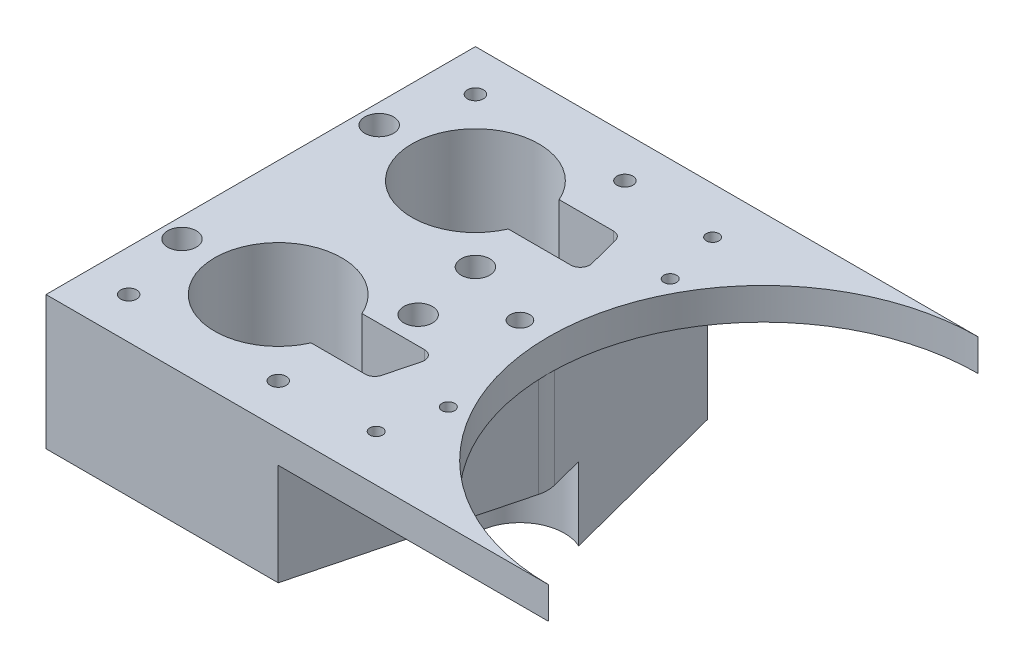
from build123d import *
from OCP.BRepFilletAPI import BRepFilletAPI_MakeChamfer

# Parameters (mm, degrees)
SALIENTE_EXTRUIR2_DEPTH     = 23
CROQUIS7_R                  = 20
CORTAR_EXTRUIR1_DEPTH       = 16
CROQUIS8_R                  = 10.25
CORTAR_EXTRUIR2_DEPTH       = 65.838641661
SALIENTE_EXTRUIR3_START     = 32
CROQUIS9_R                  = 20
CROQUIS9_R_2                = 3.075
CROQUIS9_R_3                = 10.25
SALIENTE_EXTRUIR3_DEPTH     = 32
CORTAR_EXTRUIR3_START       = -7
CROQUIS10_R                 = 20
CORTAR_EXTRUIR3_DEPTH       = 112.607172695
SALIENTE_EXTRUIR4_START     = 20
CROQUIS11_R                 = 3.075
CROQUIS11_R_2               = 20
SALIENTE_EXTRUIR4_DEPTH     = 20
CROQUIS12_R                 = 63
CORTAR_EXTRUIR4_DEPTH       = 3
CROQUIS13_R                 = 55
CORTAR_EXTRUIR5_DEPTH       = 10
SALIENTE_EXTRUIR5_START     = 10
SALIENTE_EXTRUIR5_DEPTH     = 10
CHAFL_N1_SIZE               = 8
CHAFL_N1_SIZE2              = 4.618802154
CROQUIS15_R                 = 6
CORTAR_EXTRUIR6_DEPTH       = 14.8
CORTAR_EXTRUIR7_REACH       = 233.334
CROQUIS17_R                 = 1.5
CORTAR_EXTRUIR9_REACH       = 225.907
CROQUIS19_R                 = 1.5
CORTAR_EXTRUIR10_DEPTH      = 232.333633525
CORTAR_EXTRUIR11_DEPTH      = 50
CROQUIS22_R                 = 3
CORTAR_EXTRUIR12_DEPTH      = 3
CROQUIS23_R                 = 3
CORTAR_EXTRUIR13_DEPTH      = 3
CROQUIS25_R                 = 2.5
CORTAR_EXTRUIR15_DEPTH      = 224.906788642
CROQUIS24_R                 = 2.5
CORTAR_EXTRUIR14_DEPTH      = 232.333633525
CROQUIS26_R                 = 2
CORTAR_EXTRUIR16_DEPTH      = 223.070371729
CROQUIS27_R                 = 3.5
CORTAR_EXTRUIR17_DEPTH      = 5
CORTAR_EXTRUIR18_DEPTH      = 3.25
CROQUIS29_R                 = 1.5
CORTAR_EXTRUIR19_DEPTH      = 10
CORTAR_EXTRUIR20_DEPTH      = 223.070371729
CORTAR_EXTRUIR20_DEPTH_BACK = 223.070371729
CROQUIS30_R                 = 67.5
CROQUIS31_R                 = 2.5
CORTAR_EXTRUIR21_DEPTH      = 180.872176837
CROQUIS32_R                 = 4.5
CORTAR_EXTRUIR22_DEPTH      = 5
CROQUIS33_W                 = 158
CROQUIS33_H                 = 20
CORTAR_EXTRUIR23_DEPTH      = 202.442299431
CROQUIS34_R                 = 4.5
CORTAR_EXTRUIR24_DEPTH      = 12
CROQUIS35_R                 = 4.5
CORTAR_EXTRUIR25_DEPTH      = 45
CROQUIS36_R                 = 4.5
CORTAR_EXTRUIR26_DEPTH      = 23
CROQUIS37_R                 = 4.5
CORTAR_EXTRUIR27_DEPTH      = 23.6
CORTAR_EXTRUIR28_DEPTH      = 35
CORTAR_EXTRUIR29_DEPTH      = 23


with BuildPart() as part:
    # Croquis2 → Saliente-Extruir2 (new body)
    with BuildSketch(Plane(origin=(0, 0, 0), x_dir=(1, 0, 0), z_dir=(0, 1, 0))):
        with BuildLine():
            Line((32.725022686, -35), (-35, -35))
            Line((-35, -35), (-35, 35))
            Line((-35, 35), (38, 35))
            Line((38, 35), (52.182846342, -19.705264464))
            ThreePointArc((52.182846342, -19.705264464), (38.869791903, -20.762030653), (32.5, -32.5))
            ThreePointArc((32.5, -32.5), (32.556369153, -33.755053307), (32.725022686, -35))
        make_face()
    extrude(amount=SALIENTE_EXTRUIR2_DEPTH)

    # Croquis7 → Cortar-Extruir1 (cut)
    with BuildSketch(Plane(origin=(0, 23, 0), x_dir=(1, 0, 0), z_dir=(0, 1, 0))):
        with Locations(Location((1.5, -1.5, 0), (0, 0, 270))):
            Circle(CROQUIS7_R)
    extrude(amount=-CORTAR_EXTRUIR1_DEPTH, mode=Mode.SUBTRACT)

    # Croquis8 → Cortar-Extruir2 (cut, through all)
    with BuildSketch(Plane(origin=(0, 7, 0), x_dir=(1, 0, 0), z_dir=(0, 1, 0))):
        with Locations(Location((1.5, -1.5, 0), (0, 0, 270))):
            Circle(CROQUIS8_R)
    extrude(amount=-CORTAR_EXTRUIR2_DEPTH, mode=Mode.SUBTRACT)

    # Croquis9 → Saliente-Extruir3 (add)
    with BuildSketch(Plane(origin=(0, 23, 0), x_dir=(1, 0, 0), z_dir=(0, 1, 0)).offset(SALIENTE_EXTRUIR3_START)):
        with BuildLine():
            Line((-35, 35), (-35, -100))
            Line((-35, -100), (38, -100))
            Line((38, -100), (54.849357366, -35.009621588))
            ThreePointArc((54.849357366, -35.009621588), (55.169388384, -32.5), (54.849357366, -29.990378412))
            Line((54.849357366, -29.990378412), (38, 35))
            Line((38, 35), (-35, 35))
        make_face()
        with Locations(Location((1.5, -1.5, 0), (0, 0, 270))):
            Circle(CROQUIS9_R, mode=Mode.SUBTRACT)
        with Locations(Location((46.5, -32.5, 0), (0, 0, 270))):
            Circle(CROQUIS9_R_2, mode=Mode.SUBTRACT)
        with Locations(Location((1.5, -63.5, 0), (0, 0, 90))):
            Circle(CROQUIS9_R_3, mode=Mode.SUBTRACT)
    extrude(amount=-SALIENTE_EXTRUIR3_DEPTH)

    # Croquis10 → Cortar-Extruir3 (cut, through all)
    with BuildSketch(Plane.XZ.offset(-23).offset(CORTAR_EXTRUIR3_START)):
        with Locations(Location((1.5, 63.5, 0), (0, 0, 90))):
            Circle(CROQUIS10_R)
    extrude(amount=-CORTAR_EXTRUIR3_DEPTH, mode=Mode.SUBTRACT)

    # Croquis11 → Saliente-Extruir4 (add)
    with BuildSketch(Plane(origin=(0, 55, 0), x_dir=(1, 0, 0), z_dir=(0, 1, 0)).offset(SALIENTE_EXTRUIR4_START)):
        with BuildLine():
            Line((123, 35), (-35, 35))
            Line((-35, 35), (-35, -100))
            Line((-35, -100), (123, -100))
            ThreePointArc((123, -100), (190.5, -32.5), (123, 35))
        make_face()
        with Locations(Location((46.5, -32.5, 0), (0, 0, 270))):
            Circle(CROQUIS11_R, mode=Mode.SUBTRACT)
        with Locations(Location((1.5, -63.5, 0), (0, 0, 270))):
            Circle(CROQUIS11_R_2, mode=Mode.SUBTRACT)
        with Locations(Location((1.5, -1.5, 0), (0, 0, 270))):
            Circle(CROQUIS11_R_2, mode=Mode.SUBTRACT)
    extrude(amount=-SALIENTE_EXTRUIR4_DEPTH)

    # Croquis12 → Cortar-Extruir4 (cut)
    with BuildSketch(Plane.XZ.offset(-55)):
        with Locations(Location((123, 32.5, 0), (0, 0, 270))):
            Circle(CROQUIS12_R)
    extrude(amount=-CORTAR_EXTRUIR4_DEPTH, mode=Mode.SUBTRACT)

    # Croquis13 → Cortar-Extruir5 (cut)
    with BuildSketch(Plane.XZ.offset(-58)):
        with Locations(Location((123, 32.5, 0), (0, 0, 270))):
            Circle(CROQUIS13_R)
    extrude(amount=-CORTAR_EXTRUIR5_DEPTH, mode=Mode.SUBTRACT)

    # Croquis14 → Saliente-Extruir5 (add)
    with BuildSketch(Plane(origin=(0, 75, 0), x_dir=(1, 0, 0), z_dir=(0, 1, 0)).offset(SALIENTE_EXTRUIR5_START)):
        with BuildLine():
            Line((-35, -100), (123, -100))
            ThreePointArc((123, -100), (190.5, -32.5), (123, 35))
            Line((123, 35), (-35, 35))
            Line((-35, 35), (-35, -100))
        make_face()
    extrude(amount=-SALIENTE_EXTRUIR5_DEPTH)

    # Chaflán1: one chamfer whose edges measure the first distance from different faces: ONE call of the kernel's chamfer builder (chamfer() names one face for all edges)
    chafl_n1_edges_1 = [part.edges().sort_by_distance(p)[0] for p in [
        (190.5, 85, 32.5),
    ]]
    chafl_n1_side_1 = [part.faces().sort_by_distance(p)[0] for p in [
        (190.5, 70, 32.5),
    ]]
    chafl_n1_edges_2 = [part.edges().sort_by_distance(p)[0] for p in [
        (44, 85, -35),
    ]]
    chafl_n1_side_2 = [part.faces().sort_by_distance(p)[0] for p in [
        (24.509708738, 50.509708738, -35),
    ]]
    chafl_n1_edges_3 = [part.edges().sort_by_distance(p)[0] for p in [
        (44, 85, 100),
    ]]
    chafl_n1_side_3 = [part.faces().sort_by_distance(p)[0] for p in [
        (29.969474279, 59.765969474, 100),
    ]]
    chafl_n1 = BRepFilletAPI_MakeChamfer(part.part.solid().wrapped)
    for e in chafl_n1_edges_1:
        chafl_n1.Add(CHAFL_N1_SIZE, CHAFL_N1_SIZE2, e.wrapped, chafl_n1_side_1[0].wrapped)  # the first distance lies on this face
    for e in chafl_n1_edges_2:
        chafl_n1.Add(CHAFL_N1_SIZE, CHAFL_N1_SIZE2, e.wrapped, chafl_n1_side_2[0].wrapped)  # the first distance lies on this face
    for e in chafl_n1_edges_3:
        chafl_n1.Add(CHAFL_N1_SIZE, CHAFL_N1_SIZE2, e.wrapped, chafl_n1_side_3[0].wrapped)  # the first distance lies on this face
    add(Compound.cast(chafl_n1.Shape()), mode=Mode.REPLACE)

    # Croquis15 → Cortar-Extruir6 (cut)
    with BuildSketch(Plane.XZ.offset(-68)):
        with Locations(Location((123, 32.5, 0), (0, 0, 270))):
            Circle(CROQUIS15_R)
    extrude(amount=-CORTAR_EXTRUIR6_DEPTH, mode=Mode.SUBTRACT)

    # Croquis17 → Cortar-Extruir7 (cut, up to next)
    with BuildSketch(Plane.XZ, mode=Mode.PRIVATE) as cortar_extruir7_sk1:
        with Locations(Location((16.5, 1.5, 0), (0, 0, 270))):
            Circle(CROQUIS17_R)
    cortar_extruir7_tool1 = extrude(cortar_extruir7_sk1.sketch, amount=-CORTAR_EXTRUIR7_REACH, mode=Mode.PRIVATE) & part.part
    # Croquis17 → Cortar-Extruir7 (cut, up to next)
    with BuildSketch(Plane.XZ, mode=Mode.PRIVATE) as cortar_extruir7_sk2:
        with Locations(Location((-6, -11.490381057, 0), (0, 0, 270))):
            Circle(CROQUIS17_R)
    cortar_extruir7_tool2 = extrude(cortar_extruir7_sk2.sketch, amount=-CORTAR_EXTRUIR7_REACH, mode=Mode.PRIVATE) & part.part
    # Croquis17 → Cortar-Extruir7 (cut, up to next)
    with BuildSketch(Plane.XZ, mode=Mode.PRIVATE) as cortar_extruir7_sk3:
        with Locations(Location((-6, 14.490381057, 0), (0, 0, 270))):
            Circle(CROQUIS17_R)
    cortar_extruir7_tool3 = extrude(cortar_extruir7_sk3.sketch, amount=-CORTAR_EXTRUIR7_REACH, mode=Mode.PRIVATE) & part.part
    # Croquis17 → Cortar-Extruir7 (cut, up to next)
    with BuildSketch(Plane.XZ, mode=Mode.PRIVATE) as cortar_extruir7_sk4:
        with Locations(Location((13.624355653, 8.5, 0), (0, 0, 270))):
            Circle(CROQUIS17_R)
    cortar_extruir7_tool4 = extrude(cortar_extruir7_sk4.sketch, amount=-CORTAR_EXTRUIR7_REACH, mode=Mode.PRIVATE) & part.part
    # Croquis17 → Cortar-Extruir7 (cut, up to next)
    with BuildSketch(Plane.XZ, mode=Mode.PRIVATE) as cortar_extruir7_sk5:
        with Locations(Location((1.5, -12.5, 0), (0, 0, 270))):
            Circle(CROQUIS17_R)
    cortar_extruir7_tool5 = extrude(cortar_extruir7_sk5.sketch, amount=-CORTAR_EXTRUIR7_REACH, mode=Mode.PRIVATE) & part.part
    # Croquis17 → Cortar-Extruir7 (cut, up to next)
    with BuildSketch(Plane.XZ, mode=Mode.PRIVATE) as cortar_extruir7_sk6:
        with Locations(Location((-10.624355653, 8.5, 0), (0, 0, 270))):
            Circle(CROQUIS17_R)
    cortar_extruir7_tool6 = extrude(cortar_extruir7_sk6.sketch, amount=-CORTAR_EXTRUIR7_REACH, mode=Mode.PRIVATE) & part.part
    add(cortar_extruir7_tool1.solids().sort_by_distance((16.5, 0, 1.5))[0], mode=Mode.SUBTRACT)
    add(cortar_extruir7_tool2.solids().sort_by_distance((-6, 0, -11.490381))[0], mode=Mode.SUBTRACT)
    add(cortar_extruir7_tool3.solids().sort_by_distance((-6, 0, 14.490381))[0], mode=Mode.SUBTRACT)
    add(cortar_extruir7_tool4.solids().sort_by_distance((13.624356, 0, 8.5))[0], mode=Mode.SUBTRACT)
    add(cortar_extruir7_tool5.solids().sort_by_distance((1.5, 0, -12.5))[0], mode=Mode.SUBTRACT)
    add(cortar_extruir7_tool6.solids().sort_by_distance((-10.624356, 0, 8.5))[0], mode=Mode.SUBTRACT)

    # Croquis19 → Cortar-Extruir9 (cut, up to next)
    with BuildSketch(Plane.XZ.offset(-23), mode=Mode.PRIVATE) as cortar_extruir9_sk1:
        with Locations(Location((16.5, 63.5, 0), (0, 0, 270))):
            Circle(CROQUIS19_R)
    cortar_extruir9_tool1 = extrude(cortar_extruir9_sk1.sketch, amount=-CORTAR_EXTRUIR9_REACH, mode=Mode.PRIVATE) & part.part
    # Croquis19 → Cortar-Extruir9 (cut, up to next)
    with BuildSketch(Plane.XZ.offset(-23), mode=Mode.PRIVATE) as cortar_extruir9_sk2:
        with Locations(Location((-6, 50.509618943, 0), (0, 0, 270))):
            Circle(CROQUIS19_R)
    cortar_extruir9_tool2 = extrude(cortar_extruir9_sk2.sketch, amount=-CORTAR_EXTRUIR9_REACH, mode=Mode.PRIVATE) & part.part
    # Croquis19 → Cortar-Extruir9 (cut, up to next)
    with BuildSketch(Plane.XZ.offset(-23), mode=Mode.PRIVATE) as cortar_extruir9_sk3:
        with Locations(Location((-6, 76.490381057, 0), (0, 0, 270))):
            Circle(CROQUIS19_R)
    cortar_extruir9_tool3 = extrude(cortar_extruir9_sk3.sketch, amount=-CORTAR_EXTRUIR9_REACH, mode=Mode.PRIVATE) & part.part
    # Croquis19 → Cortar-Extruir9 (cut, up to next)
    with BuildSketch(Plane.XZ.offset(-23), mode=Mode.PRIVATE) as cortar_extruir9_sk4:
        with Locations(Location((13.624355653, 70.5, 0), (0, 0, 270))):
            Circle(CROQUIS19_R)
    cortar_extruir9_tool4 = extrude(cortar_extruir9_sk4.sketch, amount=-CORTAR_EXTRUIR9_REACH, mode=Mode.PRIVATE) & part.part
    # Croquis19 → Cortar-Extruir9 (cut, up to next)
    with BuildSketch(Plane.XZ.offset(-23), mode=Mode.PRIVATE) as cortar_extruir9_sk5:
        with Locations(Location((1.5, 49.5, 0), (0, 0, 270))):
            Circle(CROQUIS19_R)
    cortar_extruir9_tool5 = extrude(cortar_extruir9_sk5.sketch, amount=-CORTAR_EXTRUIR9_REACH, mode=Mode.PRIVATE) & part.part
    # Croquis19 → Cortar-Extruir9 (cut, up to next)
    with BuildSketch(Plane.XZ.offset(-23), mode=Mode.PRIVATE) as cortar_extruir9_sk6:
        with Locations(Location((-10.624355653, 70.5, 0), (0, 0, 270))):
            Circle(CROQUIS19_R)
    cortar_extruir9_tool6 = extrude(cortar_extruir9_sk6.sketch, amount=-CORTAR_EXTRUIR9_REACH, mode=Mode.PRIVATE) & part.part
    add(cortar_extruir9_tool1.solids().sort_by_distance((16.5, 23, 63.5))[0], mode=Mode.SUBTRACT)
    add(cortar_extruir9_tool2.solids().sort_by_distance((-6, 23, 50.509619))[0], mode=Mode.SUBTRACT)
    add(cortar_extruir9_tool3.solids().sort_by_distance((-6, 23, 76.490381))[0], mode=Mode.SUBTRACT)
    add(cortar_extruir9_tool4.solids().sort_by_distance((13.624356, 23, 70.5))[0], mode=Mode.SUBTRACT)
    add(cortar_extruir9_tool5.solids().sort_by_distance((1.5, 23, 49.5))[0], mode=Mode.SUBTRACT)
    add(cortar_extruir9_tool6.solids().sort_by_distance((-10.624356, 23, 70.5))[0], mode=Mode.SUBTRACT)

    # Croquis20 → Cortar-Extruir10 (cut, through all)
    with BuildSketch(Plane.XZ):
        with BuildLine():
            Line((42.3656995, 5.747113524), (39.773106907, -4.252886476))
            ThreePointArc((39.773106907, -4.252886476), (38.705054743, -5.872620854), (36.869116213, -6.5))
            Line((36.869116213, -6.5), (19.83030278, -6.5))
            ThreePointArc((19.83030278, -6.5), (21.5, 1.5), (19.83030278, 9.5))
            Line((19.83030278, 9.5), (39.461708805, 9.5))
            ThreePointArc((39.461708805, 9.5), (41.834329659, 8.33593853), (42.3656995, 5.747113524))
        make_face()
    extrude(amount=-CORTAR_EXTRUIR10_DEPTH, mode=Mode.SUBTRACT)

    # Croquis21 → Cortar-Extruir11 (cut)
    with BuildSketch(Plane.XZ.offset(-23)):
        with BuildLine():
            Line((39.461708805, 55.5), (19.83030278, 55.5))
            ThreePointArc((19.83030278, 55.5), (21.5, 63.5), (19.83030278, 71.5))
            Line((19.83030278, 71.5), (36.869116213, 71.5))
            ThreePointArc((36.869116213, 71.5), (38.705054743, 70.872620854), (39.773106907, 69.252886476))
            Line((39.773106907, 69.252886476), (42.3656995, 59.252886476))
            ThreePointArc((42.3656995, 59.252886476), (41.834329659, 56.66406147), (39.461708805, 55.5))
        make_face()
    extrude(amount=-CORTAR_EXTRUIR11_DEPTH, mode=Mode.SUBTRACT)

    # Croquis22 → Cortar-Extruir12 (cut)
    with BuildSketch(Plane.XZ):
        with Locations(Location((-6, 14.490381057, 0), (0, 0, 270))):
            Circle(CROQUIS22_R)
        with Locations(Location((-10.624355653, 8.5, 0), (0, 0, 270))):
            Circle(CROQUIS22_R)
        with Locations(Location((-6, -11.490381057, 0), (0, 0, 270))):
            Circle(CROQUIS22_R)
        with Locations(Location((1.5, -12.5, 0), (0, 0, 270))):
            Circle(CROQUIS22_R)
        with Locations(Location((16.5, 1.5, 0), (0, 0, 270))):
            Circle(CROQUIS22_R)
        with Locations(Location((13.624355653, 8.5, 0), (0, 0, 270))):
            Circle(CROQUIS22_R)
    extrude(amount=-CORTAR_EXTRUIR12_DEPTH, mode=Mode.SUBTRACT)

    # Croquis23 → Cortar-Extruir13 (cut)
    with BuildSketch(Plane.XZ.offset(-23)):
        with Locations(Location((-6, 76.490381057, 0), (0, 0, 270))):
            Circle(CROQUIS23_R)
        with Locations(Location((-10.624355653, 70.5, 0), (0, 0, 270))):
            Circle(CROQUIS23_R)
        with Locations(Location((-6, 50.509618943, 0), (0, 0, 270))):
            Circle(CROQUIS23_R)
        with Locations(Location((1.5, 49.5, 0), (0, 0, 270))):
            Circle(CROQUIS23_R)
        with Locations(Location((16.5, 63.5, 0), (0, 0, 270))):
            Circle(CROQUIS23_R)
        with Locations(Location((13.624355653, 70.5, 0), (0, 0, 270))):
            Circle(CROQUIS23_R)
    extrude(amount=-CORTAR_EXTRUIR13_DEPTH, mode=Mode.SUBTRACT)

    # Croquis25 → Cortar-Extruir15 (cut, through all)
    with BuildSketch(Plane.XZ.offset(-23)):
        with Locations(Location((-28.75, 63.5, 0), (0, 0, 270))):
            Circle(CROQUIS25_R)
        with Locations(Location((29, 47, 0), (0, 0, 270))):
            Circle(CROQUIS25_R)
    extrude(amount=-CORTAR_EXTRUIR15_DEPTH, mode=Mode.SUBTRACT)

    # Croquis24 → Cortar-Extruir14 (cut, through all)
    with BuildSketch(Plane.XZ):
        with Locations(Location((-28.75, 1.5, 0), (0, 0, 270))):
            Circle(CROQUIS24_R)
        with Locations(Location((25, 25, 0), (0, 0, 270))):
            Circle(CROQUIS24_R)
    extrude(amount=-CORTAR_EXTRUIR14_DEPTH, mode=Mode.SUBTRACT)

    # Croquis26 → Cortar-Extruir16 (cut, through all)
    with BuildSketch(Plane.XZ.offset(-55)):
        with Locations(Location((54.186793756, 85.381197846, 0), (0, 0, 270))):
            Circle(CROQUIS26_R)
        with Locations(Location((58.853460423, 67.381197846, 0), (0, 0, 270))):
            Circle(CROQUIS26_R)
        with Locations(Location((58.853460423, -2.381197846, 0), (0, 0, 90))):
            Circle(CROQUIS26_R)
        with Locations(Location((54.186793756, -20.381197846, 0), (0, 0, 90))):
            Circle(CROQUIS26_R)
    extrude(amount=-CORTAR_EXTRUIR16_DEPTH, mode=Mode.SUBTRACT)

    # Croquis27 → Cortar-Extruir17 (cut)
    with BuildSketch(Plane(origin=(0, 85, 0), x_dir=(1, 0, 0), z_dir=(0, 1, 0))):
        with Locations(Location((54.186793756, 20.381197846, 0), (0, 0, 270))):
            Circle(CROQUIS27_R)
        with Locations(Location((58.853460423, 2.381197846, 0), (0, 0, 270))):
            Circle(CROQUIS27_R)
        with Locations(Location((58.853460423, -67.381197846, 0), (0, 0, 270))):
            Circle(CROQUIS27_R)
        with Locations(Location((54.186793756, -85.381197846, 0), (0, 0, 270))):
            Circle(CROQUIS27_R)
    extrude(amount=-CORTAR_EXTRUIR17_DEPTH, mode=Mode.SUBTRACT)

    # Croquis28 → Cortar-Extruir18 (cut)
    with BuildSketch(Plane.XZ.offset(-55)):
        Polygon((55.222779206, 81.385253968), (58.165375392, 84.280415625), (57.129389942, 88.276359503), (53.150808306, 89.377141725), (50.20821212, 86.481980068), (51.24419757, 82.48603619), align=None)
        Polygon((59.889445873, 63.385253968), (62.832042059, 66.280415625), (61.796056609, 70.276359503), (57.817474973, 71.377141725), (54.874878787, 68.481980068), (55.910864237, 64.48603619), align=None)
        Polygon((59.889445873, 1.614746032), (55.910864237, 0.51396381), (54.874878787, -3.481980068), (57.817474973, -6.377141725), (61.796056609, -5.276359503), (62.832042059, -1.280415625), align=None)
        Polygon((55.222779206, -16.385253968), (51.24419757, -17.48603619), (50.20821212, -21.481980068), (53.150808306, -24.377141725), (57.129389942, -23.276359503), (58.165375392, -19.280415625), align=None)
    extrude(amount=-CORTAR_EXTRUIR18_DEPTH, mode=Mode.SUBTRACT)

    # Croquis29 → Cortar-Extruir19 (cut)
    with BuildSketch(Plane.XZ.offset(-68)):
        with Locations(Location((160.5, 32.5, 0), (0, 0, 270))):
            Circle(CROQUIS29_R)
        with Locations(Location((141.75, 0.024047358, 0), (0, 0, 270))):
            Circle(CROQUIS29_R)
        with Locations(Location((104.25, 0.024047358, 0), (0, 0, 270))):
            Circle(CROQUIS29_R)
        with Locations(Location((85.5, 32.5, 0), (0, 0, 270))):
            Circle(CROQUIS29_R)
        with Locations(Location((104.25, 64.975952642, 0), (0, 0, 270))):
            Circle(CROQUIS29_R)
        with Locations(Location((141.75, 64.975952642, 0), (0, 0, 270))):
            Circle(CROQUIS29_R)
    extrude(amount=-CORTAR_EXTRUIR19_DEPTH, mode=Mode.SUBTRACT)

    # Croquis30 → Cortar-Extruir20 (cut, two sides: drawn at the far end of the back side and taken through both)
    with BuildSketch(Plane.XZ.offset(-55).offset(-CORTAR_EXTRUIR20_DEPTH_BACK)):
        with Locations((123, 32.5)):
            Circle(CROQUIS30_R)
    extrude(amount=CORTAR_EXTRUIR20_DEPTH + CORTAR_EXTRUIR20_DEPTH_BACK, mode=Mode.SUBTRACT)

    # Croquis31 → Cortar-Extruir21 (cut, through all)
    with BuildSketch(Plane(origin=(0, 85, 0), x_dir=(1, 0, 0), z_dir=(0, 1, 0))):
        with Locations(Location((-22, 22, 0), (0, 0, 270))):
            Circle(CROQUIS31_R)
        with Locations(Location((25, 22, 0), (0, 0, 270))):
            Circle(CROQUIS31_R)
        with Locations(Location((25, -87, 0), (0, 0, 270))):
            Circle(CROQUIS31_R)
        with Locations(Location((-22, -87, 0), (0, 0, 270))):
            Circle(CROQUIS31_R)
    extrude(amount=-CORTAR_EXTRUIR21_DEPTH, mode=Mode.SUBTRACT)

    # Croquis32 → Cortar-Extruir22 (cut)
    with BuildSketch(Plane(origin=(0, 85, 0), x_dir=(1, 0, 0), z_dir=(0, 1, 0))):
        with Locations(Location((-22, 22, 0), (0, 0, 270))):
            Circle(CROQUIS32_R)
        with Locations(Location((25, 22, 0), (0, 0, 270))):
            Circle(CROQUIS32_R)
        with Locations(Location((-22, -87, 0), (0, 0, 270))):
            Circle(CROQUIS32_R)
        with Locations(Location((25, -87, 0), (0, 0, 270))):
            Circle(CROQUIS32_R)
    extrude(amount=-CORTAR_EXTRUIR22_DEPTH, mode=Mode.SUBTRACT)

    # Croquis33 → Cortar-Extruir23 (cut, through all)
    with BuildSketch(Plane(origin=(0, 0, -35), x_dir=(-1, 0, 0), z_dir=(0, 0, -1))):
        with Locations((-44, 75)):
            Rectangle(CROQUIS33_W, CROQUIS33_H)
    extrude(amount=-CORTAR_EXTRUIR23_DEPTH, mode=Mode.SUBTRACT)

    # Croquis34 → Cortar-Extruir24 (cut)
    with BuildSketch(Plane(origin=(0, 65, 0), x_dir=(1, 0, 0), z_dir=(0, 1, 0))):
        with Locations(Location((-28.75, -63.5, 0), (0, 0, 180))):
            Circle(CROQUIS34_R)
    extrude(amount=-CORTAR_EXTRUIR24_DEPTH, mode=Mode.SUBTRACT)

    # Croquis35 → Cortar-Extruir25 (cut)
    with BuildSketch(Plane(origin=(0, 65, 0), x_dir=(1, 0, 0), z_dir=(0, 1, 0))):
        with Locations(Location((-28.75, -1.5, 0), (0, 0, 180))):
            Circle(CROQUIS35_R)
    extrude(amount=-CORTAR_EXTRUIR25_DEPTH, mode=Mode.SUBTRACT)

    # Croquis36 → Cortar-Extruir26 (cut)
    with BuildSketch(Plane(origin=(0, 65, 0), x_dir=(1, 0, 0), z_dir=(0, 1, 0))):
        with Locations(Location((29, -47, 0), (0, 0, 180))):
            Circle(CROQUIS36_R)
    extrude(amount=-CORTAR_EXTRUIR26_DEPTH, mode=Mode.SUBTRACT)

    # Croquis37 → Cortar-Extruir27 (cut)
    with BuildSketch(Plane(origin=(0, 65, 0), x_dir=(1, 0, 0), z_dir=(0, 1, 0))):
        with Locations(Location((25, -25, 0), (0, 0, 180))):
            Circle(CROQUIS37_R)
    extrude(amount=-CORTAR_EXTRUIR27_DEPTH, mode=Mode.SUBTRACT)

    # Croquis38 → Cortar-Extruir28 (cut)
    with BuildSketch(Plane.XZ):
        Polygon((-17.236860279, -22), (-19.61843014, -17.875), (-24.38156986, -17.875), (-26.763139721, -22), (-24.38156986, -26.125), (-19.61843014, -26.125), align=None)
        Polygon((29.763139721, -22), (27.38156986, -17.875), (22.61843014, -17.875), (20.236860279, -22), (22.61843014, -26.125), (27.38156986, -26.125), align=None)
        Polygon((-17.236860279, 87), (-19.61843014, 91.125), (-24.38156986, 91.125), (-26.763139721, 87), (-24.38156986, 82.875), (-19.61843014, 82.875), align=None)
        Polygon((29.763139721, 87), (27.38156986, 91.125), (22.61843014, 91.125), (20.236860279, 87), (22.61843014, 82.875), (27.38156986, 82.875), align=None)
    extrude(amount=-CORTAR_EXTRUIR28_DEPTH, mode=Mode.SUBTRACT)

    # Croquis39 → Cortar-Extruir29 (cut)
    with BuildSketch(Plane.XZ):
        with BuildLine():
            Line((-14, 21.115045246), (-14, 30))
            Line((-14, 30), (-30, 30))
            Line((-30, 30), (-30, 14))
            Line((-30, 14), (-20.150635095, 14))
            ThreePointArc((-20.150635095, 14), (-17.412915936, 17.849361174), (-14, 21.115045246))
        make_face()
        with BuildLine():
            Line((-30, -30), (-30, -14))
            Line((-30, -14), (-18.115045246, -14))
            ThreePointArc((-18.115045246, -14), (1.5, -23.5), (21.115045246, -14))
            Line((21.115045246, -14), (38.279138637, -14))
            Line((38.279138637, -14), (34.130990489, -30))
            Line((34.130990489, -30), (-30, -30))
        make_face()
    extrude(amount=-CORTAR_EXTRUIR29_DEPTH, mode=Mode.SUBTRACT)


solid = part.part
